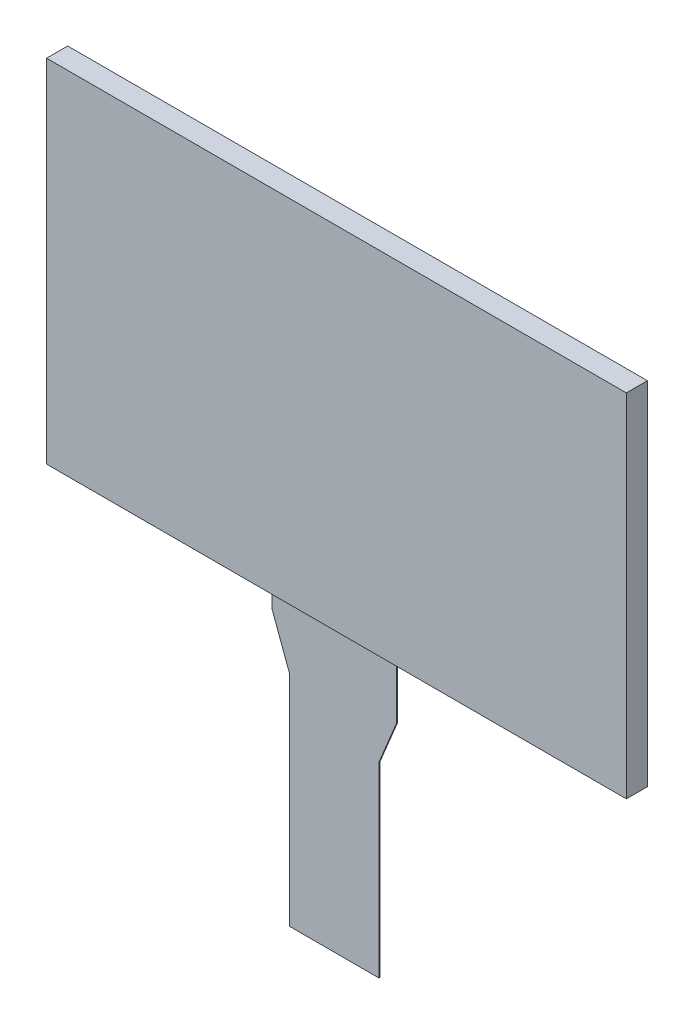
from build123d import *

# Parameters (mm, degrees)
SKETCH_1_W            = 164.9
SKETCH_1_H            = 100
EXTRUDE_319_DEPTH     = 6
SKETCH_2_W            = 156.7
SKETCH_2_H            = 89.1
CUT_EXTRUDE_496_DEPTH = 0.1
SKETCH_4_W            = 35.5
SKETCH_4_H            = 0.3
EXTRUDE_2_DEPTH       = 80.15
CUT_EXTRUDE_4_DEPTH   = 155.144566884
SKETCH_6_W            = 25.5
SKETCH_6_H            = 3.8
CUT_EXTRUDE_5_DEPTH   = 0.05


with BuildPart() as part:
    # 草图1 → Extrude 319 (new body)
    with BuildSketch(Plane.XY):
        Rectangle(SKETCH_1_W, SKETCH_1_H)
    extrude(amount=EXTRUDE_319_DEPTH)

    # 草图2 → Cut-Extrude 496 (cut)
    with BuildSketch(Plane.XY):
        with Locations((1.39, 1.88)):
            Rectangle(SKETCH_2_W, SKETCH_2_H)
    extrude(amount=CUT_EXTRUDE_496_DEPTH, mode=Mode.SUBTRACT)

    # 草图4 → 凸台-拉伸2 (add)
    with BuildSketch(Plane.XZ.offset(50)):
        with Locations((-1.5, 5)):
            Rectangle(SKETCH_4_W, SKETCH_4_H)
    extrude(amount=EXTRUDE_2_DEPTH)

    # 草图5 → 切除-拉伸4 (cut, through all)
    with BuildSketch(Plane(origin=(0, 0, 4.85), x_dir=(-1, 0, 0), z_dir=(0, 0, -1))):
        Polygon((-16.25, -130.15), (-11.25, -130.15), (-11.25, -76.987179315), (-16.25, -64.867086026), align=None)
        Polygon((19.25, -130.15), (14.25, -130.15), (14.25, -67.739612604), (19.25, -54.255364134), align=None)
    extrude(amount=-CUT_EXTRUDE_4_DEPTH, mode=Mode.SUBTRACT)

    # 草图6 → 切除-拉伸5 (cut)
    with BuildSketch(Plane(origin=(0, 0, 4.85), x_dir=(-1, 0, 0), z_dir=(0, 0, -1))):
        with Locations((1.5, -128.25)):
            Rectangle(SKETCH_6_W, SKETCH_6_H)
    extrude(amount=-CUT_EXTRUDE_5_DEPTH, mode=Mode.SUBTRACT)


solid = part.part
